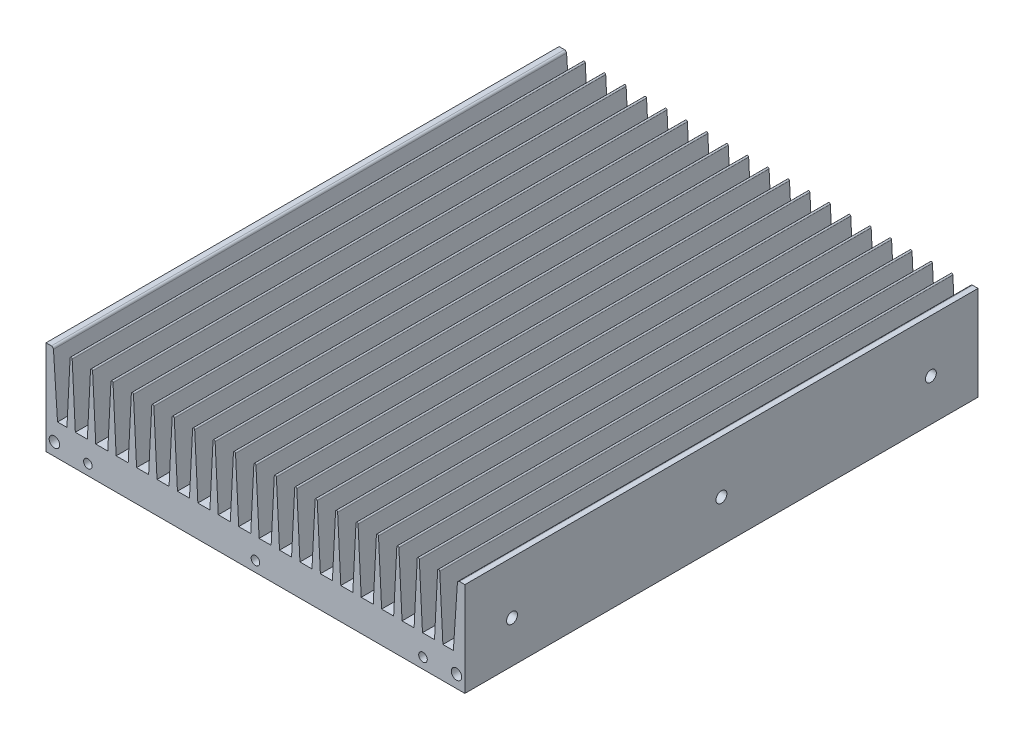
from build123d import *

# Parameters (mm, degrees)
EXTRUDE_1_DEPTH       = 245
EXTRUDE_3_DEPTH       = 245
PATTERN_CURVE_1_COUNT = 19
PATTERN_CURVE_1_PITCH = 9.75
SKETCH_3_R            = 2.05
CUT_EXTRUDE_1_DEPTH   = 10
CUT_EXTRUDE_START     = -10
SKETCH_5_R            = 2.05
CUT_EXTRUDE_2_DEPTH   = 10
SKETCH_6_R            = 2.5
CUT_EXTRUDE_3_DEPTH   = 8
SKETCH_7_R            = 2.6
CUT_EXTRUDE_4_DEPTH   = 6
SKETCH_8_R            = 4.5
SKETCH_8_R_2          = 3.4
CUT_EXTRUDE_5_DEPTH   = 6
CUT_EXTRUDE_START_2   = -6
SKETCH_9_R            = 2.6
CUT_EXTRUDE_6_DEPTH   = 6
SKETCH_10_R           = 3.4
SKETCH_10_R_2         = 4.5
CUT_EXTRUDE_7_DEPTH   = 6
EXTRUDE_4_REACH       = 321.453
SKETCH_11_R           = 2.6
EXTRUDE_5_REACH       = 321.453
SKETCH_12_R           = 4.5
SKETCH_12_R_2         = 3.4
CUT_EXTRUDE_START_3   = -8
SKETCH_14_R           = 2.5
CUT_EXTRUDE_9_DEPTH   = 8
SKETCH_18_R           = 2.1
SKETCH_18_R_2         = 1.6
SKETCH_18_R_3         = 1.3
SKETCH_18_R_4         = 2.6
CUT_EXTRUDE_11_DEPTH  = 8


with BuildPart() as part:
    # Эскиз1 → Вытянуть1 (new body)
    with BuildSketch(Plane.XY):
        with BuildLine():
            Line((0, 45), (2.564446908, 45))
            ThreePointArc((2.564446908, 45), (3.247630994, 44.730246195), (3.562232066, 44.066519011))
            Line((3.562232066, 44.066519011), (5.5, 15))
            Line((5.5, 15), (194.5, 15))
            Line((194.5, 15), (196.437767934, 44.066519011))
            ThreePointArc((196.437767934, 44.066519011), (196.752369006, 44.730246195), (197.435553092, 45))
            Line((197.435553092, 45), (200, 45))
            Line((200, 45), (200, 0))
            Line((200, 0), (0, 0))
            Line((0, 0), (0, 45))
        make_face()
    extrude(amount=EXTRUDE_1_DEPTH)

    # Эскиз2 → Вытянуть3 (add)
    with BuildSketch(Plane.XY.offset(245)):
        with BuildLine():
            Line((11.5, 44.5), (10, 15))
            Line((10, 15), (14, 15))
            Line((14, 15), (12.5, 44.5))
            ThreePointArc((12.5, 44.5), (12, 45), (11.5, 44.5))
        make_face()
    extrude_3 = extrude(amount=-EXTRUDE_3_DEPTH)

    # Кривая1: Вытянуть3 ×19
    with Locations(*[(i * PATTERN_CURVE_1_PITCH, 0, 0) for i in range(1, PATTERN_CURVE_1_COUNT)]):
        add(extrude_3)

    # Эскиз3 → Вырез-Вытянуть1 (cut)
    with BuildSketch(Plane.XY.offset(245)):
        with Locations((20, 5)):
            Circle(SKETCH_3_R)
        with Locations((100, 5)):
            Circle(SKETCH_3_R)
        with Locations((180, 5)):
            Circle(SKETCH_3_R)
    extrude(amount=-CUT_EXTRUDE_1_DEPTH, mode=Mode.SUBTRACT)

    # Эскиз5 → Вырез-Вытянуть2 (cut)
    with BuildSketch(Plane(origin=(0, 0, 0), x_dir=(-1, 0, 0), z_dir=(0, 0, -1)).offset(CUT_EXTRUDE_START)):
        with Locations(Location((-180, 5, 0), (0, 0, 180))):
            Circle(SKETCH_5_R)
        with Locations(Location((-100, 5, 0), (0, 0, 180))):
            Circle(SKETCH_5_R)
        with Locations(Location((-20, 5, 0), (0, 0, 180))):
            Circle(SKETCH_5_R)
    extrude(amount=CUT_EXTRUDE_2_DEPTH, mode=Mode.SUBTRACT)

    # Эскиз6 → Вырез-Вытянуть3 (cut)
    with BuildSketch(Plane(origin=(0, 0, 0), x_dir=(-1, 0, 0), z_dir=(0, 0, -1))):
        with Locations((-4, 6)):
            Circle(SKETCH_6_R)
        with Locations(Location((-196, 6, 0), (0, 0, 180))):
            Circle(SKETCH_6_R)
    extrude(amount=-CUT_EXTRUDE_3_DEPTH, mode=Mode.SUBTRACT)

    # Эскиз7 → Вырез-Вытянуть4 (cut)
    with BuildSketch(Plane.ZY):
        with Locations(Location((22.5, 20, 0), (0, 0, 270))):
            Circle(SKETCH_7_R)
        with Locations(Location((222.5, 20, 0), (0, 0, 270))):
            Circle(SKETCH_7_R)
        with Locations(Location((122.5, 20, 0), (0, 0, 270))):
            Circle(SKETCH_7_R)
    extrude(amount=-CUT_EXTRUDE_4_DEPTH, mode=Mode.SUBTRACT)

    # Эскиз8 → Вырез-Вытянуть5 (cut)
    with BuildSketch(Plane(origin=(200, 0, 0), x_dir=(0, 0, -1), z_dir=(1, 0, 0))):
        with Locations((-80, 30)):
            Circle(SKETCH_8_R)
        with Locations((-165, 30)):
            Circle(SKETCH_8_R_2)
    extrude(amount=-CUT_EXTRUDE_5_DEPTH, mode=Mode.SUBTRACT)

    # Эскиз9 → Вырез-Вытянуть6 (cut)
    with BuildSketch(Plane(origin=(200, 0, 0), x_dir=(0, 0, -1), z_dir=(1, 0, 0)).offset(CUT_EXTRUDE_START_2)):
        with Locations(Location((-22.5, 20, 0), (0, 0, 270))):
            Circle(SKETCH_9_R)
        with Locations(Location((-122.5, 20, 0), (0, 0, 270))):
            Circle(SKETCH_9_R)
        with Locations(Location((-222.5, 20, 0), (0, 0, 270))):
            Circle(SKETCH_9_R)
    extrude(amount=CUT_EXTRUDE_6_DEPTH, mode=Mode.SUBTRACT)

    # Эскиз10 → Вырез-Вытянуть7 (cut)
    with BuildSketch(Plane.ZY.offset(CUT_EXTRUDE_START_2)):
        with Locations(Location((165, 30, 0), (0, 0, 180))):
            Circle(SKETCH_10_R)
        with Locations(Location((80, 30, 0), (0, 0, 180))):
            Circle(SKETCH_10_R_2)
    extrude(amount=CUT_EXTRUDE_7_DEPTH, mode=Mode.SUBTRACT)

    # Вытянуть4: up to this face of the body (flat: up to its plane)
    extrude_4_end = Plane(part.part.faces().sort_by_distance((4.525743195, 29.613852069, 122.666761542))[0])
    # Эскиз11 → Вытянуть4 (add, up to the picked face)
    with BuildSketch(Plane.ZY, mode=Mode.PRIVATE) as extrude_4_sk1:
        with Locations(Location((22.5, 20, 0), (0, 0, 180))):
            Circle(SKETCH_11_R)
    extrude_4_tool1 = split(extrude(extrude_4_sk1.sketch, amount=-EXTRUDE_4_REACH, mode=Mode.PRIVATE), bisect_by=extrude_4_end, keep=Keep.BOTH, mode=Mode.PRIVATE)
    # Эскиз11 → Вытянуть4 (add, up to the picked face)
    with BuildSketch(Plane.ZY, mode=Mode.PRIVATE) as extrude_4_sk2:
        with Locations(Location((122.5, 20, 0), (0, 0, 180))):
            Circle(SKETCH_11_R)
    extrude_4_tool2 = split(extrude(extrude_4_sk2.sketch, amount=-EXTRUDE_4_REACH, mode=Mode.PRIVATE), bisect_by=extrude_4_end, keep=Keep.BOTH, mode=Mode.PRIVATE)
    # Эскиз11 → Вытянуть4 (add, up to the picked face)
    with BuildSketch(Plane.ZY, mode=Mode.PRIVATE) as extrude_4_sk3:
        with Locations(Location((222.5, 20, 0), (0, 0, 180))):
            Circle(SKETCH_11_R)
    extrude_4_tool3 = split(extrude(extrude_4_sk3.sketch, amount=-EXTRUDE_4_REACH, mode=Mode.PRIVATE), bisect_by=extrude_4_end, keep=Keep.BOTH, mode=Mode.PRIVATE)
    add(extrude_4_tool1.solids().sort_by(Axis((0, 20, 22.5), (1, 0, 0)))[0])
    add(extrude_4_tool2.solids().sort_by(Axis((0, 20, 122.5), (1, 0, 0)))[0])
    add(extrude_4_tool3.solids().sort_by(Axis((0, 20, 222.5), (1, 0, 0)))[0])

    # Вытянуть5: up to this face of the body (flat: up to its plane)
    extrude_5_end = Plane(part.part.faces().sort_by_distance((195.474256805, 29.613852069, 122.666761542))[0])
    # Эскиз12 → Вытянуть5 (add, up to the picked face)
    with BuildSketch(Plane(origin=(200, 0, 0), x_dir=(0, 0, -1), z_dir=(1, 0, 0)), mode=Mode.PRIVATE) as extrude_5_sk1:
        with Locations(Location((-80, 30, 0), (0, 0, 270))):
            Circle(SKETCH_12_R)
    extrude_5_tool1 = split(extrude(extrude_5_sk1.sketch, amount=-EXTRUDE_5_REACH, mode=Mode.PRIVATE), bisect_by=extrude_5_end, keep=Keep.BOTH, mode=Mode.PRIVATE)
    # Эскиз12 → Вытянуть5 (add, up to the picked face)
    with BuildSketch(Plane(origin=(200, 0, 0), x_dir=(0, 0, -1), z_dir=(1, 0, 0)), mode=Mode.PRIVATE) as extrude_5_sk2:
        with Locations(Location((-165, 30, 0), (0, 0, 270))):
            Circle(SKETCH_12_R_2)
    extrude_5_tool2 = split(extrude(extrude_5_sk2.sketch, amount=-EXTRUDE_5_REACH, mode=Mode.PRIVATE), bisect_by=extrude_5_end, keep=Keep.BOTH, mode=Mode.PRIVATE)
    add(extrude_5_tool1.solids().sort_by(Axis((200, 30, 80), (-1, 0, 0)))[0])
    add(extrude_5_tool2.solids().sort_by(Axis((200, 30, 165), (-1, 0, 0)))[0])

    # Эскиз14 → Вырез-Вытянуть9 (cut)
    with BuildSketch(Plane.XY.offset(245).offset(CUT_EXTRUDE_START_3)):
        with Locations(Location((4, 6, 0), (0, 0, 180))):
            Circle(SKETCH_14_R)
        with Locations((196, 6)):
            Circle(SKETCH_14_R)
    extrude(amount=CUT_EXTRUDE_9_DEPTH, mode=Mode.SUBTRACT)

    # Эскиз18 → Вырез-Вытянуть11 (cut)
    with BuildSketch(Plane.XZ):
        with Locations((118, 203)):
            Circle(SKETCH_18_R)
        with Locations((63, 12.5)):
            Circle(SKETCH_18_R_2)
        with Locations((173, 12.5)):
            Circle(SKETCH_18_R_2)
        with Locations((173, 162.5)):
            Circle(SKETCH_18_R_2)
        with Locations((63, 162.5)):
            Circle(SKETCH_18_R_2)
        with Locations((101.5, 132.5)):
            Circle(SKETCH_18_R_3)
        with Locations((135, 132.5)):
            Circle(SKETCH_18_R_3)
        with Locations((148, 94.5)):
            Circle(SKETCH_18_R_4)
    extrude(amount=-CUT_EXTRUDE_11_DEPTH, mode=Mode.SUBTRACT)


solid = part.part
